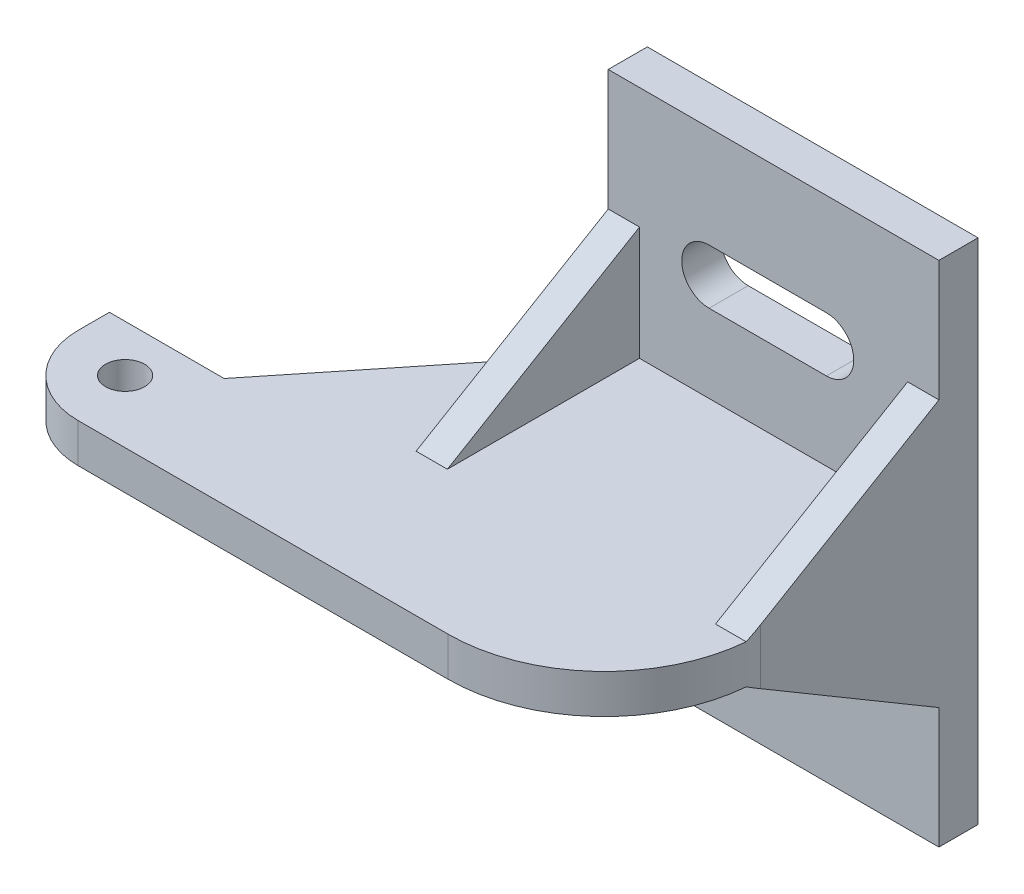
from build123d import *

# Parameters (mm, degrees)
BOSS_EXTRUDE1_DEPTH      = 5
BOSS_EXTRUDE4_DEPTH      = 30
BOSS_EXTRUDE4_DEPTH_BACK = 35
SKETCH5_W                = 42.3
SKETCH5_H                = 5
CUT_EXTRUDE5_DEPTH       = 10
SKETCH9_W                = 14
SKETCH9_H                = 5
BOSS_EXTRUDE5_DEPTH      = 35
FILLET1_R                = 10
BOSS_EXTRUDE6_DEPTH      = 4
BOSS_EXTRUDE7_DEPTH      = 4
SKETCH12_R               = 2.5
CUT_EXTRUDE6_DEPTH       = 79.277111821
BOSS_EXTRUDE8_DEPTH      = 5
FILLET2_R                = 20


with BuildPart() as part:
    # Sketch1 → Boss-Extrude1 (new body)
    with BuildSketch(Plane(origin=(0, 0, 0), x_dir=(1, 0, 0), z_dir=(0, 1, 0))):
        Polygon((-10.255294708, 42.808405172), (11.744705292, 42.808405172), (21.894705292, 42.808405172), (21.894705292, 3.008405172), (21.894705292, -4.991594828), (-20.405294708, -4.991594828), (-20.405294708, 3.008405172), (-20.405294708, 42.808405172), align=None)
    extrude(amount=BOSS_EXTRUDE1_DEPTH)

    # Sketch5 → Boss-Extrude4 (add, two sides: drawn at the far end of the back side and taken through both)
    with BuildSketch(Plane(origin=(0, 5, 0), x_dir=(1, 0, 0), z_dir=(0, 1, 0)).offset(-BOSS_EXTRUDE4_DEPTH_BACK)):
        with Locations((0.744705292, 40.308405172)):
            Rectangle(SKETCH5_W, SKETCH5_H)
    extrude(amount=BOSS_EXTRUDE4_DEPTH + BOSS_EXTRUDE4_DEPTH_BACK)

    # Sketch8 → Cut-Extrude5 (cut)
    with BuildSketch(Plane.XY.offset(-37.808405172)):
        with BuildLine():
            Line((-7.5, 22), (7.5, 22))
            ThreePointArc((7.5, 22), (11, 18.5), (7.5, 15))
            Line((7.5, 15), (-7.5, 15))
            ThreePointArc((-7.5, 15), (-11, 18.5), (-7.5, 22))
        make_face()
        with BuildLine():
            Line((-7.5, -10), (7.5, -10))
            ThreePointArc((7.5, -10), (11, -13.5), (7.5, -17))
            Line((7.5, -17), (-7.5, -17))
            ThreePointArc((-7.5, -17), (-11, -13.5), (-7.5, -10))
        make_face()
    extrude(amount=-CUT_EXTRUDE5_DEPTH, mode=Mode.SUBTRACT)

    # Sketch9 → Boss-Extrude5 (add)
    with BuildSketch(Plane.ZY.offset(20.405294708)):
        with Locations((-2.008405172, 2.5)):
            Rectangle(SKETCH9_W, SKETCH9_H)
    extrude(amount=BOSS_EXTRUDE5_DEPTH)

    # Fillet1
    fillet1_edges = [part.edges().sort_by_distance(p)[0] for p in [
        (-55.405294708, 2.5, 4.991594828),
    ]]
    fillet(fillet1_edges, radius=FILLET1_R)

    # Sketch10 → Boss-Extrude6 (add)
    with BuildSketch(Plane.ZY.offset(20.405294708)):
        Polygon((-42.808405172, 2.5), (-42.808405172, 22.5), (-9.008405172, 2.5), (-42.808405172, -17.5), align=None)
    extrude(amount=-BOSS_EXTRUDE6_DEPTH)

    # Sketch11 → Boss-Extrude7 (add)
    with BuildSketch(Plane(origin=(21.894705292, 0, 0), x_dir=(0, 0, -1), z_dir=(1, 0, 0))):
        Polygon((37.808405172, 19.541420118), (37.808405172, -14.541420118), (13.233405172, 0), (13.233405172, 5), align=None)
    extrude(amount=-BOSS_EXTRUDE7_DEPTH)

    # Sketch12 → Cut-Extrude6 (cut, through all)
    with BuildSketch(Plane(origin=(0, 5, 0), x_dir=(1, 0, 0), z_dir=(0, 1, 0))):
        with Locations(Location((-47.405294708, 3.008405172, 0), (0, 0, 270))):
            Circle(SKETCH12_R)
    extrude(amount=-CUT_EXTRUDE6_DEPTH, mode=Mode.SUBTRACT)

    # Sketch13 → Boss-Extrude8 (add)
    with BuildSketch(Plane.XZ):
        Polygon((-40.733122826, -9.008405172), (-20.405294708, -34.32558847), (-20.405294708, -9.008405172), align=None)
    extrude(amount=-BOSS_EXTRUDE8_DEPTH)

    # Fillet2
    fillet2_edges = [part.edges().sort_by_distance(p)[0] for p in [
        (21.894705292, 2.5, 4.991594828),
    ]]
    fillet(fillet2_edges, radius=FILLET2_R)


solid = part.part
